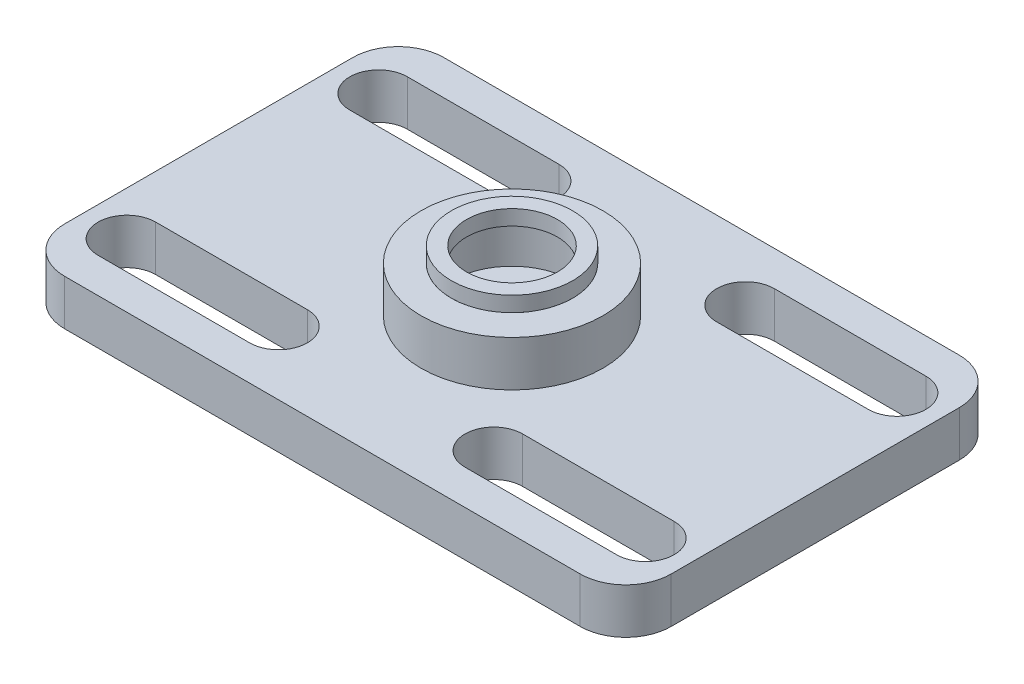
from build123d import *

# Parameters (mm, degrees)
SKETCH2_R            = 20
SKETCH2_R_2          = 15
BOSS_EXTRUDE1_DEPTH  = 5
SKETCH3_R            = 30
SKETCH3_R_2          = 20
BOSS_EXTRUDE2_DEPTH  = 15
SKETCH4_W            = 200
SKETCH4_H            = 125
BOSS_EXTRUDE3_DEPTH  = 15
FILLET1_R            = 15
CUT_EXTRUDE1_DEPTH   = 120.608737139
MIRROR2_COPY_1_DEPTH = 120.608737139


with BuildPart() as part:
    # Sketch2 → Boss-Extrude1 (new body)
    with BuildSketch(Plane(origin=(0, 0, 0), x_dir=(1, 0, 0), z_dir=(0, 1, 0))):
        with Locations(Location((0, 0, 0), (0, 0, 270))):
            Circle(SKETCH2_R)
        with Locations(Location((0, 0, 0), (0, 0, 270))):
            Circle(SKETCH2_R_2, mode=Mode.SUBTRACT)
    extrude(amount=-BOSS_EXTRUDE1_DEPTH)


with BuildPart() as body_2:
    # Sketch3 → Boss-Extrude2 (new body)
    with BuildSketch(Plane.XZ.offset(5)):
        with Locations(Location((0, 0, 0), (0, 0, 270))):
            Circle(SKETCH3_R)
        with Locations(Location((0, 0, 0), (0, 0, 270))):
            Circle(SKETCH3_R_2, mode=Mode.SUBTRACT)
    extrude(amount=BOSS_EXTRUDE2_DEPTH)

    # Sketch4 → Boss-Extrude3 (add)
    with BuildSketch(Plane.XZ.offset(20)):
        Rectangle(SKETCH4_W, SKETCH4_H)
    extrude(amount=BOSS_EXTRUDE3_DEPTH)

    # Fillet1
    fillet1_edges = [body_2.edges().sort_by_distance(p)[0] for p in [
        (100, -27.5, -62.5),
        (100, -27.5, 62.5),
        (-100, -27.5, 62.5),
        (-100, -27.5, -62.5),
    ]]
    fillet(fillet1_edges, radius=FILLET1_R)

    # Sketch5 → Cut-Extrude1 (cut, through all)
    with BuildSketch(Plane(origin=(0, -20, 0), x_dir=(1, 0, 0), z_dir=(0, 1, 0))):
        with BuildLine():
            Line((-85.5, -32), (-35.5, -32))
            ThreePointArc((-35.5, -32), (-26, -41.5), (-35.5, -51))
            Line((-35.5, -51), (-85.5, -51))
            ThreePointArc((-85.5, -51), (-95, -41.5), (-85.5, -32))
        make_face()
    cut_extrude1 = extrude(amount=-CUT_EXTRUDE1_DEPTH, mode=Mode.SUBTRACT)

    # Mirror1: Cut-Extrude1 across plane
    add(cut_extrude1.mirror(Plane.XY), mode=Mode.SUBTRACT)

    # Mirror2: Cut-Extrude1 across plane
    add(cut_extrude1.mirror(Plane(origin=(0, 0, 0), x_dir=(0, 0, 1), z_dir=(1, 0, 0))), mode=Mode.SUBTRACT)

    # Mirror2 copy 1 sketch → Mirror2 copy 1 (cut, through all)
    with BuildSketch(Plane(origin=(0, -20, 0), x_dir=(-1, 0, 0), z_dir=(0, 1, 0))):
        with BuildLine():
            Line((-85.5, -32), (-35.5, -32))
            ThreePointArc((-35.5, -32), (-26, -41.5), (-35.5, -51))
            Line((-35.5, -51), (-85.5, -51))
            ThreePointArc((-85.5, -51), (-95, -41.5), (-85.5, -32))
        make_face()
    extrude(amount=-MIRROR2_COPY_1_DEPTH, mode=Mode.SUBTRACT)


solid = Compound([part.part, body_2.part])
